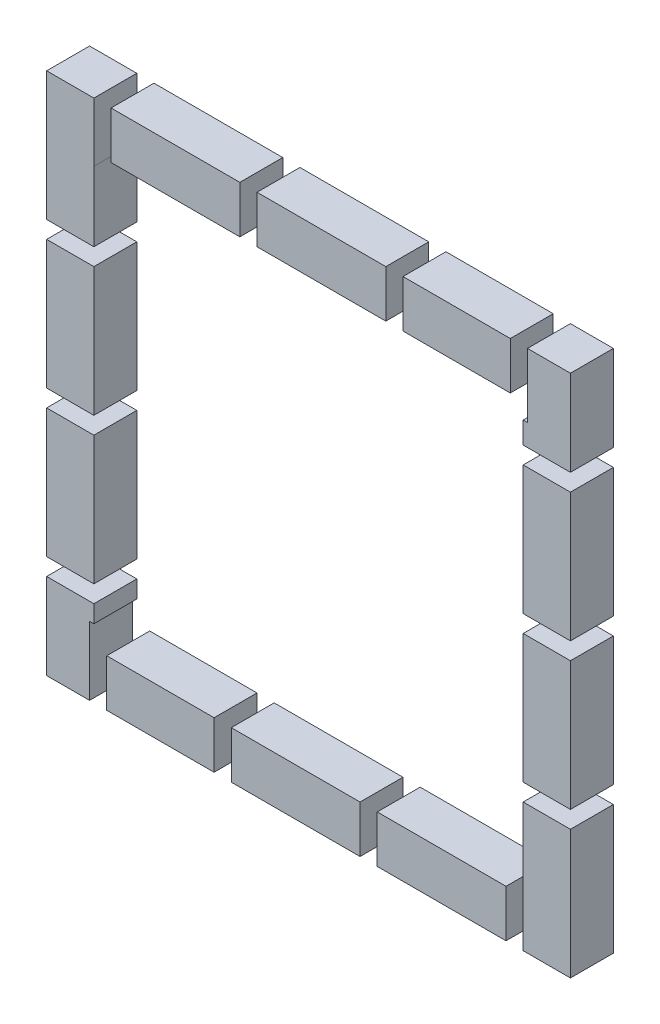
from build123d import *

# Parameters (mm, degrees)
SKETCH6_W           = 122
SKETCH6_H           = 122
SKETCH6_W_2         = 100
SKETCH6_H_2         = 100
BOSS_EXTRUDE3_DEPTH = 10
SKETCH7_W           = 4
SKETCH7_H           = 13.767715449
CUT_EXTRUDE2_DEPTH  = 10
SKETCH8_W           = 4
SKETCH8_H           = 15
CUT_EXTRUDE3_DEPTH  = 10
SKETCH9_W           = 4
SKETCH9_H           = 18
CUT_EXTRUDE4_DEPTH  = 10
SKETCH10_W          = 4
SKETCH10_H          = 16.778786697
CUT_EXTRUDE5_DEPTH  = 10
SKETCH11_W          = 4
SKETCH11_H          = 17.459048521
CUT_EXTRUDE7_DEPTH  = 10
SKETCH12_W          = 4
SKETCH12_H          = 21.812422706
CUT_EXTRUDE9_DEPTH  = 10
SKETCH13_W          = 4
SKETCH13_H          = 17.574592677
CUT_EXTRUDE10_DEPTH = 10
SKETCH14_W          = 4
SKETCH14_H          = 21.309059105
CUT_EXTRUDE11_DEPTH = 10
SKETCH15_W          = 17.282150298
SKETCH15_H          = 4
CUT_EXTRUDE12_DEPTH = 10
SKETCH16_W          = 20.302331903
SKETCH16_H          = 4
CUT_EXTRUDE13_DEPTH = 10
SKETCH18_W          = 17.114362431
SKETCH18_H          = 4
CUT_EXTRUDE15_DEPTH = 10
SKETCH19_W          = 18.2888775
SKETCH19_H          = 4
CUT_EXTRUDE16_DEPTH = 10
SKETCH20_W          = 17.953301765
SKETCH20_H          = 4
CUT_EXTRUDE17_DEPTH = 10
SKETCH21_W          = 23.154725642
SKETCH21_H          = 4
CUT_EXTRUDE19_DEPTH = 10


with BuildPart() as part:
    # Sketch6 → Boss-Extrude3 (new body)
    with BuildSketch(Plane.XY):
        with Locations((-149.462365591, 55.107526882)):
            Rectangle(SKETCH6_W, SKETCH6_H)
        with Locations((-149.462365591, 55.107526882)):
            Rectangle(SKETCH6_W_2, SKETCH6_H_2, mode=Mode.SUBTRACT)
    extrude(amount=BOSS_EXTRUDE3_DEPTH)

    # Sketch7 → Cut-Extrude2 (cut)
    with BuildSketch(Plane.XY):
        with Locations((-197.463365591, 109.223669158)):
            Rectangle(SKETCH7_W, SKETCH7_H)
    extrude(amount=CUT_EXTRUDE2_DEPTH, mode=Mode.SUBTRACT)

    # Sketch8 → Cut-Extrude3 (cut)
    with BuildSketch(Plane.XY):
        with Locations((-163.463365591, 110.846538635)):
            Rectangle(SKETCH8_W, SKETCH8_H)
    extrude(amount=CUT_EXTRUDE3_DEPTH, mode=Mode.SUBTRACT)


with BuildPart() as cut_extrude3_piece_1:
    # of the separate pieces the step leaves, piece 1, a body of its own (cut_extrude3_pieces)
    add(part.part.solids().sort_by_distance((-210.462365591, 116.107526882, 0))[0])

    # Sketch9 → Cut-Extrude4 (cut)
    with BuildSketch(Plane.XY):
        with Locations((-129.463365591, 107.107526882)):
            Rectangle(SKETCH9_W, SKETCH9_H)
    extrude(amount=CUT_EXTRUDE4_DEPTH, mode=Mode.SUBTRACT)


with BuildPart() as cut_extrude3_piece_2:
    # of the separate pieces the step leaves, piece 2, a body of its own (cut_extrude3_pieces)
    add(part.part.solids().sort_by_distance((-195.463365591, 116.107526882, 0))[0])


with BuildPart() as cut_extrude4_piece_1:
    # of the separate pieces the step leaves, piece 1, a body of its own (cut_extrude4_pieces)
    add(cut_extrude3_piece_1.part.solids().sort_by_distance((-210.462365591, 116.107526882, 0))[0])

    # Sketch10 → Cut-Extrude5 (cut)
    with BuildSketch(Plane.XY):
        with Locations((-100.463365591, 109.554689714)):
            Rectangle(SKETCH10_W, SKETCH10_H)
    extrude(amount=CUT_EXTRUDE5_DEPTH, mode=Mode.SUBTRACT)


with BuildPart() as cut_extrude4_piece_2:
    # of the separate pieces the step leaves, piece 2, a body of its own (cut_extrude4_pieces)
    add(cut_extrude3_piece_1.part.solids().sort_by_distance((-161.463365591, 116.107526882, 0))[0])


with BuildPart() as cut_extrude5_piece_1:
    # of the separate pieces the step leaves, piece 1, a body of its own (cut_extrude5_pieces)
    add(cut_extrude4_piece_1.part.solids().sort_by_distance((-210.462365591, 116.107526882, 0))[0])

    # Sketch11 → Cut-Extrude7 (cut)
    with BuildSketch(Plane.XY):
        with Locations((-101.463365591, 2.837051142)):
            Rectangle(SKETCH11_W, SKETCH11_H)
    extrude(amount=CUT_EXTRUDE7_DEPTH, mode=Mode.SUBTRACT)


with BuildPart() as cut_extrude5_piece_2:
    # of the separate pieces the step leaves, piece 2, a body of its own (cut_extrude5_pieces)
    add(cut_extrude4_piece_1.part.solids().sort_by_distance((-127.463365591, 116.107526882, 0))[0])


with BuildPart() as cut_extrude7_piece_1:
    # of the separate pieces the step leaves, piece 1, a body of its own (cut_extrude7_pieces)
    add(cut_extrude5_piece_1.part.solids().sort_by_distance((-210.462365591, 116.107526882, 0))[0])

    # Sketch12 → Cut-Extrude9 (cut)
    with BuildSketch(Plane.XY):
        with Locations((-135.463365591, 0.492576183)):
            Rectangle(SKETCH12_W, SKETCH12_H)
    extrude(amount=CUT_EXTRUDE9_DEPTH, mode=Mode.SUBTRACT)


with BuildPart() as cut_extrude7_piece_2:
    # of the separate pieces the step leaves, piece 2, a body of its own (cut_extrude7_pieces)
    add(cut_extrude5_piece_1.part.solids().sort_by_distance((-98.463365591, 116.107526882, 0))[0])

    # Sketch19 → Cut-Extrude16 (cut)
    with BuildSketch(Plane.XY):
        with Locations((-92.619670477, 26.107526882)):
            Rectangle(SKETCH19_W, SKETCH19_H)
    extrude(amount=CUT_EXTRUDE16_DEPTH, mode=Mode.SUBTRACT)


with BuildPart() as cut_extrude9_piece_1:
    # of the separate pieces the step leaves, piece 1, a body of its own (cut_extrude9_pieces)
    add(cut_extrude7_piece_1.part.solids().sort_by_distance((-210.462365591, 116.107526882, 0))[0])

    # Sketch13 → Cut-Extrude10 (cut)
    with BuildSketch(Plane.XY):
        with Locations((-169.463365591, 0.297173693)):
            Rectangle(SKETCH13_W, SKETCH13_H)
    extrude(amount=CUT_EXTRUDE10_DEPTH, mode=Mode.SUBTRACT)


with BuildPart() as cut_extrude9_piece_2:
    # of the separate pieces the step leaves, piece 2, a body of its own (cut_extrude9_pieces)
    add(cut_extrude7_piece_1.part.solids().sort_by_distance((-103.463365591, -5.892473118, 0))[0])


with BuildPart() as cut_extrude10_piece_1:
    # of the separate pieces the step leaves, piece 1, a body of its own (cut_extrude10_pieces)
    add(cut_extrude9_piece_1.part.solids().sort_by_distance((-210.462365591, 116.107526882, 0))[0])

    # Sketch14 → Cut-Extrude11 (cut)
    with BuildSketch(Plane.XY):
        with Locations((-198.463365591, -0.598044951)):
            Rectangle(SKETCH14_W, SKETCH14_H)
    extrude(amount=CUT_EXTRUDE11_DEPTH, mode=Mode.SUBTRACT)


with BuildPart() as cut_extrude10_piece_2:
    # of the separate pieces the step leaves, piece 2, a body of its own (cut_extrude10_pieces)
    add(cut_extrude9_piece_1.part.solids().sort_by_distance((-137.463365591, -5.892473118, 0))[0])


with BuildPart() as cut_extrude11_piece_1:
    # of the separate pieces the step leaves, piece 1, a body of its own (cut_extrude11_pieces)
    add(cut_extrude10_piece_1.part.solids().sort_by_distance((-210.462365591, 116.107526882, 0))[0])

    # Sketch15 → Cut-Extrude12 (cut)
    with BuildSketch(Plane.XY):
        with Locations((-203.909528423, 84.107526882)):
            Rectangle(SKETCH15_W, SKETCH15_H)
    extrude(amount=CUT_EXTRUDE12_DEPTH, mode=Mode.SUBTRACT)


with BuildPart() as cut_extrude11_piece_2:
    # of the separate pieces the step leaves, piece 2, a body of its own (cut_extrude11_pieces)
    add(cut_extrude10_piece_1.part.solids().sort_by_distance((-171.463365591, -5.892473118, 0))[0])


with BuildPart() as cut_extrude12_piece_1:
    # of the separate pieces the step leaves, piece 1, a body of its own (cut_extrude12_pieces)
    add(cut_extrude11_piece_1.part.solids().sort_by_distance((-200.463365591, -5.892473118, 0))[0])

    # Sketch16 → Cut-Extrude13 (cut)
    with BuildSketch(Plane.XY):
        with Locations((-203.406164821, 50.107526882)):
            Rectangle(SKETCH16_W, SKETCH16_H)
    extrude(amount=CUT_EXTRUDE13_DEPTH, mode=Mode.SUBTRACT)


with BuildPart() as cut_extrude12_piece_2:
    # of the separate pieces the step leaves, piece 2, a body of its own (cut_extrude12_pieces)
    add(cut_extrude11_piece_1.part.solids().sort_by_distance((-210.462365591, 116.107526882, 0))[0])


with BuildPart() as cut_extrude13_piece_1:
    # of the separate pieces the step leaves, piece 1, a body of its own (cut_extrude13_pieces)
    add(cut_extrude12_piece_1.part.solids().sort_by_distance((-200.463365591, -5.892473118, 0))[0])

    # Sketch18 → Cut-Extrude15 (cut)
    with BuildSketch(Plane.XY):
        with Locations((-204.161210224, 16.107526882)):
            Rectangle(SKETCH18_W, SKETCH18_H)
    extrude(amount=CUT_EXTRUDE15_DEPTH, mode=Mode.SUBTRACT)


with BuildPart() as cut_extrude13_piece_2:
    # of the separate pieces the step leaves, piece 2, a body of its own (cut_extrude13_pieces)
    add(cut_extrude12_piece_1.part.solids().sort_by_distance((-210.462365591, 52.107526882, 0))[0])


with BuildPart() as cut_extrude15_piece_1:
    # of the separate pieces the step leaves, piece 1, a body of its own (cut_extrude15_pieces)
    add(cut_extrude13_piece_1.part.solids().sort_by_distance((-210.462365591, 18.107526882, 0))[0])


with BuildPart() as cut_extrude15_piece_2:
    # of the separate pieces the step leaves, piece 2, a body of its own (cut_extrude15_pieces)
    add(cut_extrude13_piece_1.part.solids().sort_by_distance((-200.463365591, -5.892473118, 0))[0])


with BuildPart() as cut_extrude16_piece_1:
    # of the separate pieces the step leaves, piece 1, a body of its own (cut_extrude16_pieces)
    add(cut_extrude7_piece_2.part.solids().sort_by_distance((-98.463365591, 116.107526882, 0))[0])

    # Sketch20 → Cut-Extrude17 (cut)
    with BuildSketch(Plane.XY):
        with Locations((-92.83396049, 60.107526882)):
            Rectangle(SKETCH20_W, SKETCH20_H)
    extrude(amount=CUT_EXTRUDE17_DEPTH, mode=Mode.SUBTRACT)


with BuildPart() as cut_extrude16_piece_2:
    # of the separate pieces the step leaves, piece 2, a body of its own (cut_extrude16_pieces)
    add(cut_extrude7_piece_2.part.solids().sort_by_distance((-88.462365591, 24.107526882, 0))[0])


with BuildPart() as cut_extrude17_piece_1:
    # of the separate pieces the step leaves, piece 1, a body of its own (cut_extrude17_pieces)
    add(cut_extrude16_piece_1.part.solids().sort_by_distance((-98.463365591, 116.107526882, 0))[0])

    # Sketch21 → Cut-Extrude19 (cut)
    with BuildSketch(Plane.XY):
        with Locations((-93.08564229, 94.107526882)):
            Rectangle(SKETCH21_W, SKETCH21_H)
    extrude(amount=CUT_EXTRUDE19_DEPTH, mode=Mode.SUBTRACT)


with BuildPart() as cut_extrude17_piece_2:
    # of the separate pieces the step leaves, piece 2, a body of its own (cut_extrude17_pieces)
    add(cut_extrude16_piece_1.part.solids().sort_by_distance((-88.462365591, 58.107526882, 0))[0])


with BuildPart() as cut_extrude19_piece_1:
    # of the separate pieces the step leaves, piece 1, a body of its own (cut_extrude19_pieces)
    add(cut_extrude17_piece_1.part.solids().sort_by_distance((-88.462365591, 92.107526882, 0))[0])


with BuildPart() as cut_extrude19_piece_2:
    # of the separate pieces the step leaves, piece 2, a body of its own (cut_extrude19_pieces)
    add(cut_extrude17_piece_1.part.solids().sort_by_distance((-98.463365591, 116.107526882, 0))[0])


solid = Compound([cut_extrude3_piece_2.part, cut_extrude4_piece_2.part, cut_extrude5_piece_2.part, cut_extrude9_piece_2.part, cut_extrude10_piece_2.part, cut_extrude11_piece_2.part, cut_extrude12_piece_2.part, cut_extrude13_piece_2.part, cut_extrude15_piece_1.part, cut_extrude15_piece_2.part, cut_extrude16_piece_2.part, cut_extrude17_piece_2.part, cut_extrude19_piece_1.part, cut_extrude19_piece_2.part])
